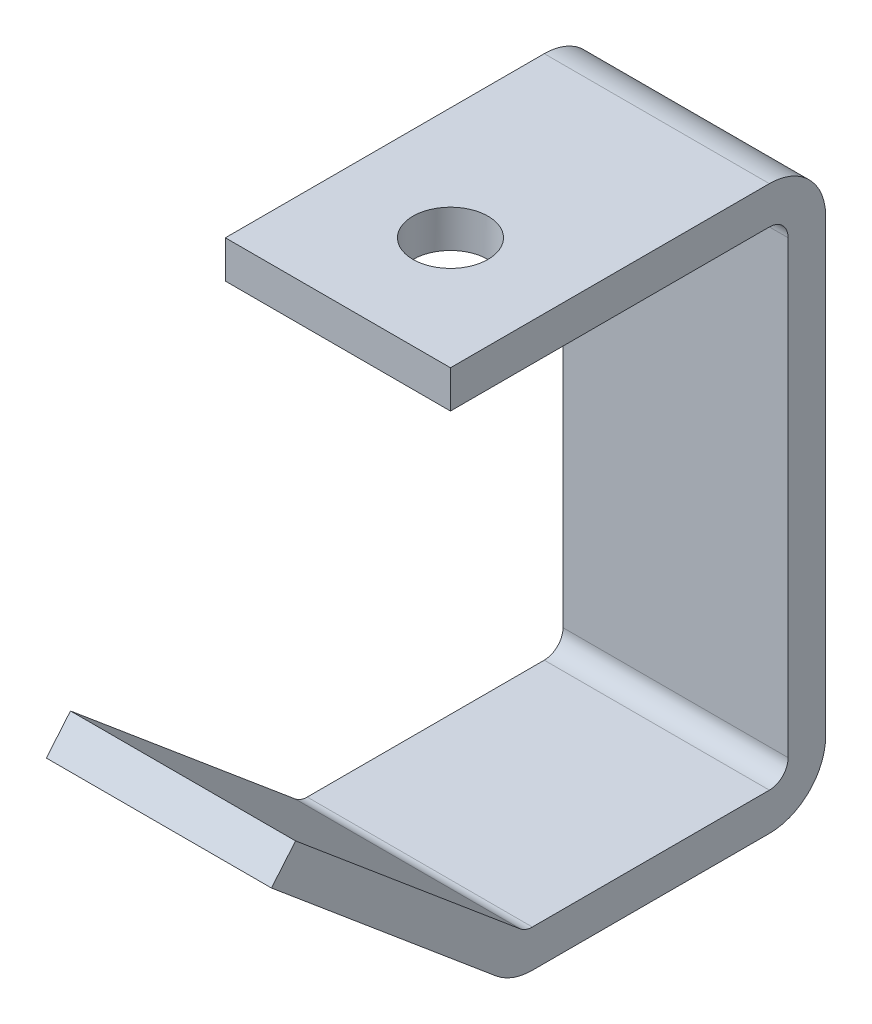
from build123d import *

# Parameters (mm, degrees)
BASE_EXTRUDE_THIN_DEPTH = 19.05
CUT_EXTRUDE1_REACH      = 132.7
SKETCH2_R               = 6.35


with BuildPart() as part:
    # Sketch1 → Base-Extrude-Thin (new, symmetric)
    with BuildSketch(Plane(origin=(0, 0, 0), x_dir=(0, 0, -1), z_dir=(1, 0, 0))):
        with BuildLine():
            Line((-83.36505771, 32.653610572), (-45.335245167, 0.742808893))
            ThreePointArc((-45.335245167, 0.742808893), (-44.380308461, 0.191475929), (-43.294394506, 0))
            Line((-43.294394506, 0), (-3.175, 0))
            ThreePointArc((-3.175, 0), (-0.92993597, 0.92993597), (0, 3.175))
            Line((0, 3.175), (0, 79.375))
            ThreePointArc((0, 79.375), (-0.92993597, 81.62006403), (-3.175, 82.55))
            Line((-3.175, 82.55), (-57.15, 82.55))
            Line((-57.15, 82.55), (-57.15, 88.9))
            Line((-57.15, 88.9), (-3.175, 88.9))
            ThreePointArc((-3.175, 88.9), (3.560192091, 86.110192091), (6.35, 79.375))
            Line((6.35, 79.375), (6.35, 3.175))
            ThreePointArc((6.35, 3.175), (3.560192091, -3.560192091), (-3.175, -6.35))
            Line((-3.175, -6.35), (-43.294394506, -6.35))
            ThreePointArc((-43.294394506, -6.35), (-46.552136371, -5.775572213), (-49.416946488, -4.121573321))
            Line((-49.416946488, -4.121573321), (-87.446759032, 27.789228358))
            Line((-87.446759032, 27.789228358), (-83.36505771, 32.653610572))
        make_face()
    extrude(amount=BASE_EXTRUDE_THIN_DEPTH, both=True)

    # Sketch2 → Cut-Extrude1 (cut, up to next)
    with BuildSketch(Plane(origin=(0, 88.9, 0), x_dir=(-1, 0, 0), z_dir=(0, 1, 0)), mode=Mode.PRIVATE) as cut_extrude1_sk1:
        with Locations(Location((0, 38.1, 0), (0, 0, 90))):
            Circle(SKETCH2_R)
    cut_extrude1_tool1 = extrude(cut_extrude1_sk1.sketch, amount=-CUT_EXTRUDE1_REACH, mode=Mode.PRIVATE) & part.part
    add(cut_extrude1_tool1.solids().sort_by_distance((0, 88.9, 38.1))[0], mode=Mode.SUBTRACT)


solid = part.part
